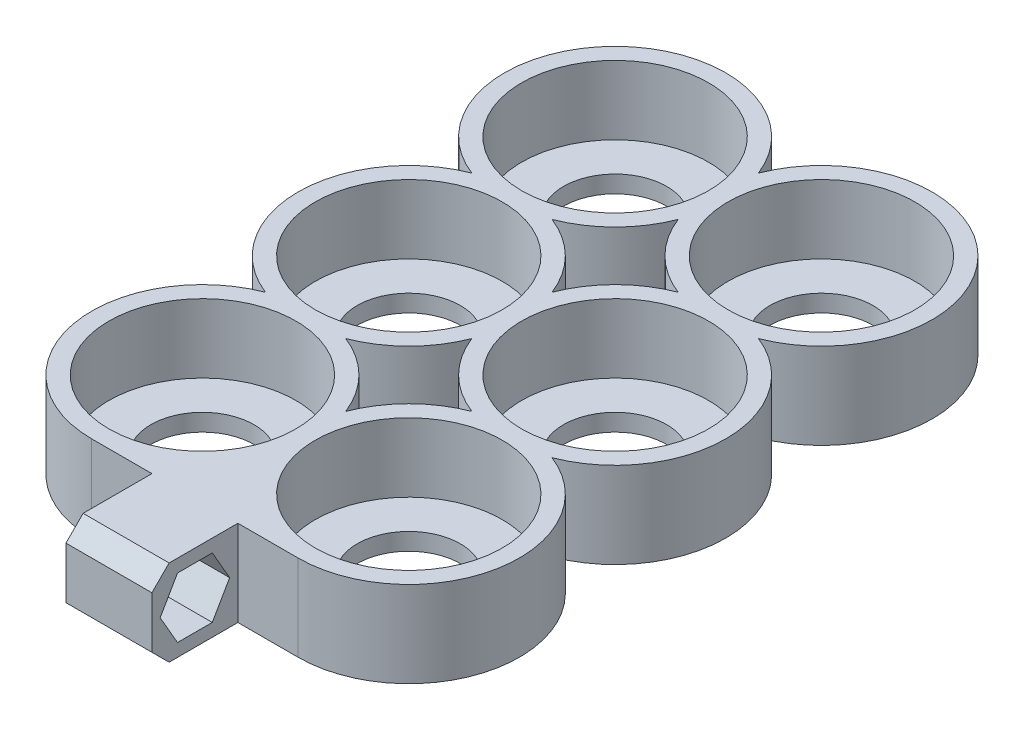
from build123d import *

# Parameters (mm, degrees)
LPATTERN1_COUNT     = 3
LPATTERN1_PITCH     = 24
LPATTERN2_COUNT     = 2
LPATTERN2_PITCH     = 24
BOSS_EXTRUDE1_REACH = 84.606
SKETCH4_W           = 24
SKETCH4_H           = 10
SKETCH5_W           = 10
SKETCH5_H           = 10
BOSS_EXTRUDE2_DEPTH = 10
CUT_EXTRUDE1_DEPTH  = 10
CHAMFER3_SIZE       = 2


with BuildPart() as part:
    # Sketch1 → Revolve1 (revolve)
    with BuildSketch(Plane(origin=(0, 0, 0), x_dir=(0, 0, -1), z_dir=(1, 0, 0))):
        Polygon((-12.875, 5), (-12.875, -5), (-6, -5), (-6, -3), (-10.875, -3), (-10.875, 5), align=None)
    revolve1 = revolve(axis=Axis((0, 27.077205882, 0), (0, -1, 0)))

    # LPattern1: Revolve1 ×3
    with Locations(*[(0, 0, -i * LPATTERN1_PITCH) for i in range(1, LPATTERN1_COUNT)]):
        add(revolve1)

    # LPattern2: Revolve1 ×2
    with Locations(*[(i * LPATTERN2_PITCH, 0, 0) for i in range(1, LPATTERN2_COUNT)]):
        add(revolve1)

    # LPattern2 copy 1 sketch → LPattern2 copy 1 (revolve)
    with BuildSketch(Plane(origin=(24, 0, -24), x_dir=(0, 0, -1), z_dir=(1, 0, 0))):
        Polygon((-12.875, 5), (-12.875, -5), (-6, -5), (-6, -3), (-10.875, -3), (-10.875, 5), align=None)
    revolve(axis=Axis((24, 27.077205882, -24), (0, -1, 0)))

    # LPattern2 copy 2 sketch → LPattern2 copy 2 (revolve)
    with BuildSketch(Plane(origin=(24, 0, -48), x_dir=(0, 0, -1), z_dir=(1, 0, 0))):
        Polygon((-12.875, 5), (-12.875, -5), (-6, -5), (-6, -3), (-10.875, -3), (-10.875, 5), align=None)
    revolve(axis=Axis((24, 27.077205882, -48), (0, -1, 0)))

    # Sketch4 → Boss-Extrude1 (add, up to next)
    with BuildSketch(Plane.XY.offset(12.875), mode=Mode.PRIVATE) as boss_extrude1_sk1:
        with Locations((12, 0)):
            Rectangle(SKETCH4_W, SKETCH4_H)
    boss_extrude1_tool1 = extrude(boss_extrude1_sk1.sketch, amount=-BOSS_EXTRUDE1_REACH, mode=Mode.PRIVATE) - part.part
    add(boss_extrude1_tool1.solids().sort_by_distance((12, 0, 12.875))[0])

    # Sketch5 → Boss-Extrude2 (add)
    with BuildSketch(Plane.XY.offset(12.875)):
        with Locations((12, 0)):
            Rectangle(SKETCH5_W, SKETCH5_H)
    extrude(amount=BOSS_EXTRUDE2_DEPTH)

    # Sketch8 → Cut-Extrude1 (cut)
    with BuildSketch(Plane.ZY.offset(-7)):
        Polygon((19.895725942, -3.5), (21.916451884, 0), (19.895725942, 3.5), (15.854274058, 3.5), (13.833548116, 0), (15.854274058, -3.5), align=None)
    extrude(amount=-CUT_EXTRUDE1_DEPTH, mode=Mode.SUBTRACT)

    # Chamfer3
    chamfer3_edges = [part.edges().sort_by_distance(p)[0] for p in [
        (12, -5, 22.875),
        (12, 5, 22.875),
    ]]
    chamfer(chamfer3_edges, length=CHAMFER3_SIZE)


solid = part.part
